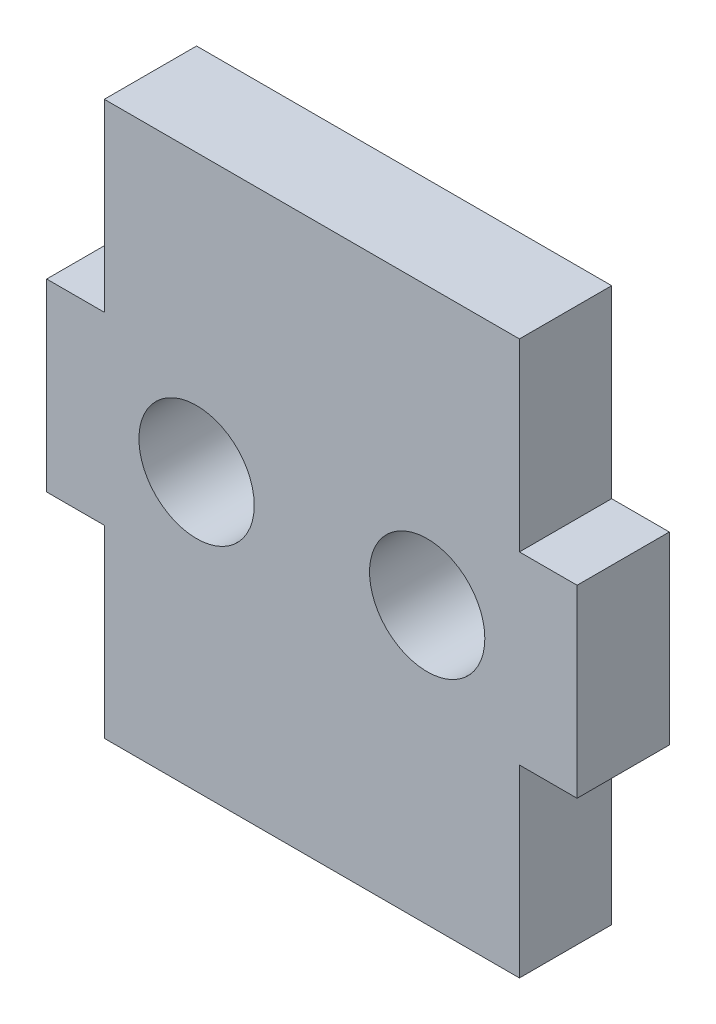
from build123d import *

# Parameters (mm, degrees)
MODEL_R             = 1.25
BOSS_EXTRUDE1_DEPTH = 2


with BuildPart() as part:
    # Model → Boss-Extrude1 (new body)
    with BuildSketch(Plane.XY):
        Polygon((1952.176808721, 1458.884115951), (1950.926808721, 1458.884115951), (1950.926808721, 1462.884115951), (1952.176808721, 1462.884115951), (1952.176808721, 1466.884115951), (1961.176808721, 1466.884115951), (1961.176808721, 1462.884115951), (1962.426808721, 1462.884115951), (1962.426808721, 1458.884115951), (1961.176808721, 1458.884115951), (1961.176808721, 1454.884115951), (1952.176808721, 1454.884115951), align=None)
        with Locations((1959.176808721, 1460.884115951)):
            Circle(MODEL_R, mode=Mode.SUBTRACT)
        with Locations((1954.176808721, 1460.884115951)):
            Circle(MODEL_R, mode=Mode.SUBTRACT)
    extrude(amount=BOSS_EXTRUDE1_DEPTH)


solid = part.part
